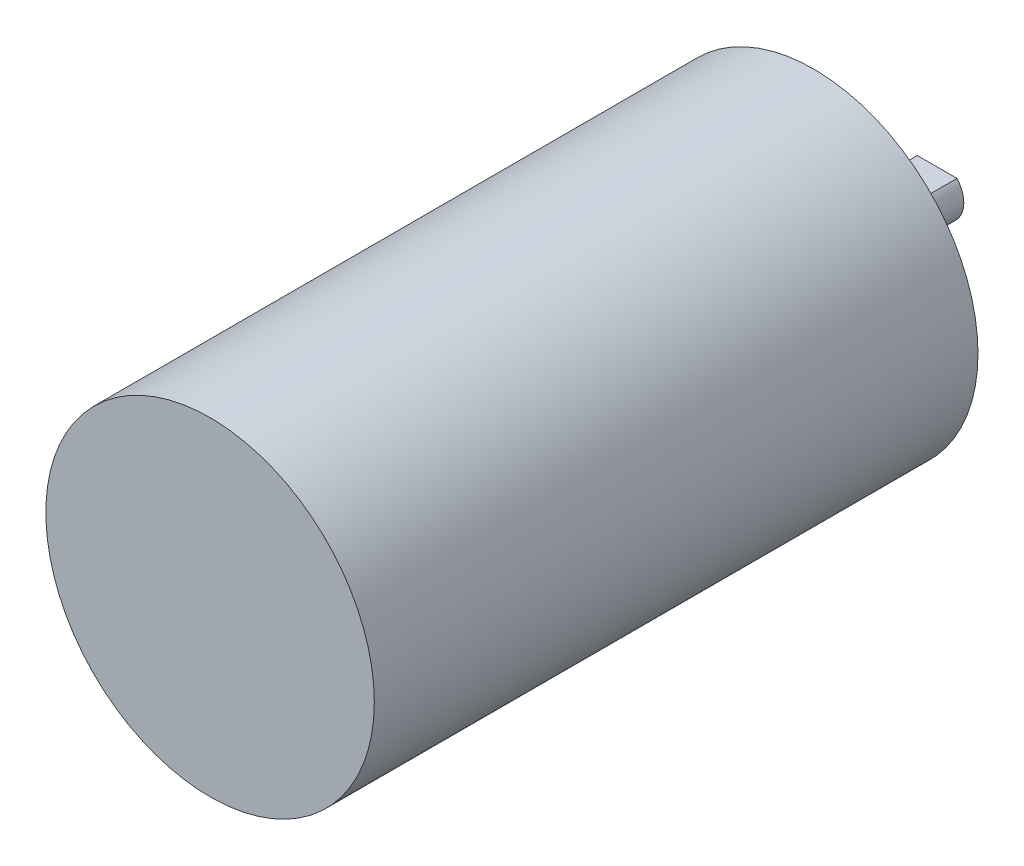
from build123d import *

# Parameters (mm, degrees)
SKETCH1_R           = 18.5
BOSS_EXTRUDE1_DEPTH = 68
SKETCH3_R           = 6
BOSS_EXTRUDE2_DEPTH = 3.5
SKETCH4_R           = 3
BOSS_EXTRUDE3_DEPTH = 10.4
CUT_EXTRUDE1_START  = -8
CUT_EXTRUDE1_DEPTH  = 8


with BuildPart() as part:
    # Sketch1 → Boss-Extrude1 (new body)
    with BuildSketch(Plane.XY):
        Circle(SKETCH1_R)
    extrude(amount=BOSS_EXTRUDE1_DEPTH)

    # Sketch3 → Boss-Extrude2 (add)
    with BuildSketch(Plane.XY):
        Circle(SKETCH3_R)
    extrude(amount=-BOSS_EXTRUDE2_DEPTH)

    # Sketch4 → Boss-Extrude3 (add)
    with BuildSketch(Plane(origin=(0, 0, -3.5), x_dir=(-1, 0, 0), z_dir=(0, 0, -1))):
        Circle(SKETCH4_R)
    extrude(amount=BOSS_EXTRUDE3_DEPTH)

    # Sketch5 → Cut-Extrude1 (cut)
    with BuildSketch(Plane(origin=(0, 0, -13.9), x_dir=(-1, 0, 0), z_dir=(0, 0, -1)).offset(CUT_EXTRUDE1_START)):
        with BuildLine():
            Line((-2.236067977, 2), (2.236067977, 2))
            ThreePointArc((2.236067977, 2), (0, 3), (-2.236067977, 2))
        make_face()
    extrude(amount=CUT_EXTRUDE1_DEPTH, mode=Mode.SUBTRACT)


solid = part.part
